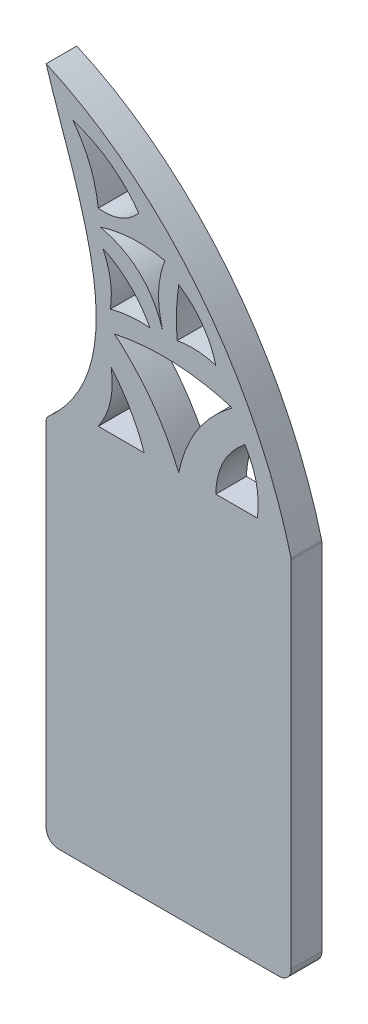
from build123d import *

# Parameters (mm, degrees)
SKETCH1_W           = 101.6
SKETCH1_H           = 152.4
BOSS_EXTRUDE1_DEPTH = 12.7
BOSS_EXTRUDE3_DEPTH = 12.7
FILLET1_R           = 2.54
FILLET2_R           = 5.08


with BuildPart() as part:
    # Sketch1 → Boss-Extrude1 (new body)
    with BuildSketch(Plane.XY):
        with Locations((50.8, 76.2)):
            Rectangle(SKETCH1_W, SKETCH1_H)
    extrude(amount=BOSS_EXTRUDE1_DEPTH)

    # Sketch2 → Boss-Extrude3 (add)
    with BuildSketch(Plane.XY):
        with BuildLine():
            add(Edge.make_bspline(
                [(0, 152.4), (39.790111277, 186.839065643), (12.30975625, 238.845497073), (0, 279.4)],
                knots=[0, 0, 0, 0, 1, 1, 1, 1], degree=3))
            add(Edge.make_bspline(
                [(0, 279.4), (51.286050257, 256.550041835), (87.836892382, 205.957944637), (101.6, 152.4)],
                knots=[0, 0, 0, 0, 1, 1, 1, 1], degree=3))
            Line((101.6, 152.4), (0, 152.4))
        make_face()
        with BuildLine():
            add(Edge.make_bspline(
                [(49.225838487, 233.315766274), (35.641228944, 236.267866949), (22.375615267, 231.937259722)],
                knots=[0, 0, 0, 1, 1, 1], degree=2))
            add(Edge.make_bspline(
                [(48.400350721, 207.535437601), (42.054170901, 227.566198031), (22.375615267, 231.937259722)],
                knots=[0, 0, 0, 1, 1, 1], degree=2))
            add(Edge.make_bspline(
                [(48.400350721, 207.535437601), (44.393568943, 220.734513873), (49.225838487, 233.315766274)],
                knots=[0, 0, 0, 1, 1, 1], degree=2))
        make_face(mode=Mode.SUBTRACT)
        with BuildLine():
            add(Edge.make_bspline(
                [(43.05348098, 206.08803494), (36.239789994, 218.91266054), (23.516066372, 224.861937296)],
                knots=[0, 0, 0, 1, 1, 1], degree=2))
            add(Edge.make_bspline(
                [(23.516066372, 224.861937296), (28.235295407, 215.21927262), (26.605728117, 204.582177714)],
                knots=[0, 0, 0, 1, 1, 1], degree=2))
            add(Edge.make_bspline(
                [(26.605728117, 204.582177714), (34.700432609, 206.792891754), (43.05348098, 206.08803494)],
                knots=[0, 0, 0, 1, 1, 1], degree=2))
        make_face(mode=Mode.SUBTRACT)
        with BuildLine():
            add(Edge.make_bspline(
                [(82.396089655, 183.81371778), (70.6713649, 174.663598784), (70.32777317, 160.02)],
                knots=[0, 0, 0, 1, 1, 1], degree=2))
            Line((70.32777317, 160.02), (87.546521436, 160.02))
            add(Edge.make_bspline(
                [(82.396089655, 183.81371778), (89.339550367, 172.773814043), (87.546521436, 160.02)],
                knots=[0, 0, 0, 1, 1, 1], degree=2))
        make_face(mode=Mode.SUBTRACT)
        with BuildLine():
            add(Edge.make_bspline(
                [(26.980466376, 183.81374211), (28.958775605, 170.837543608), (21.602944743, 160.02)],
                knots=[0, 0, 0, 1, 1, 1], degree=2))
            Line((21.602944743, 160.02), (40.676641776, 160.02))
            add(Edge.make_bspline(
                [(26.980466376, 183.81374211), (36.13847285, 173.175056715), (40.676641776, 160.02)],
                knots=[0, 0, 0, 1, 1, 1], degree=2))
        make_face(mode=Mode.SUBTRACT)
        with BuildLine():
            add(Edge.make_bspline(
                [(54.97708308, 160.02), (46.08347584, 181.54755316), (28.342136903, 196.529802482)],
                knots=[0, 0, 0, 1, 1, 1], degree=2))
            add(Edge.make_bspline(
                [(28.342136903, 196.529802482), (53.017815002, 201.732288521), (77.187204495, 194.363538628)],
                knots=[0, 0, 0, 1, 1, 1], degree=2))
            add(Edge.make_bspline(
                [(54.97708308, 160.02), (59.374728895, 181.400643158), (77.187204495, 194.363538628)],
                knots=[0, 0, 0, 1, 1, 1], degree=2))
        make_face(mode=Mode.SUBTRACT)
        with BuildLine():
            add(Edge.make_bspline(
                [(70.328259561, 206.277457578), (62.361576962, 208.669014941), (54.287141362, 207.109917469)],
                knots=[0, 0, 0, 1, 1, 1], degree=2))
            add(Edge.make_bspline(
                [(54.287141362, 207.109917469), (53.482096811, 217.391663167), (54.97708308, 227.557269012)],
                knots=[0, 0, 0, 1, 1, 1], degree=2))
            add(Edge.make_bspline(
                [(54.97708308, 227.557269012), (66.645859754, 219.852180834), (70.328259561, 206.277457578)],
                knots=[0, 0, 0, 1, 1, 1], degree=2))
        make_face(mode=Mode.SUBTRACT)
        with BuildLine():
            add(Edge.make_bspline(
                [(21.602944743, 238.323137826), (19.95197567, 252.974545225), (11.094737768, 264.601494061)],
                knots=[0, 0, 0, 1, 1, 1], degree=2))
            add(Edge.make_bspline(
                [(11.094737768, 264.601494061), (28.053835186, 259.295838115), (38.412267282, 244.949944056)],
                knots=[0, 0, 0, 1, 1, 1], degree=2))
            add(Edge.make_bspline(
                [(21.602944743, 238.323137826), (31.864782779, 237.284469605), (38.412267282, 244.949944056)],
                knots=[0, 0, 0, 1, 1, 1], degree=2))
        make_face(mode=Mode.SUBTRACT)
    extrude(amount=BOSS_EXTRUDE3_DEPTH)

    # Fillet1
    fillet1_edges = [part.edges().sort_by_distance(p)[0] for p in [
        (101.6, 152.4, 6.35),
        (0, 152.4, 6.35),
    ]]
    fillet(fillet1_edges, radius=FILLET1_R)

    # Fillet2
    fillet2_edges = [part.edges().sort_by_distance(p)[0] for p in [
        (0, 0, 6.35),
        (101.6, 0, 6.35),
    ]]
    fillet(fillet2_edges, radius=FILLET2_R)


solid = part.part
